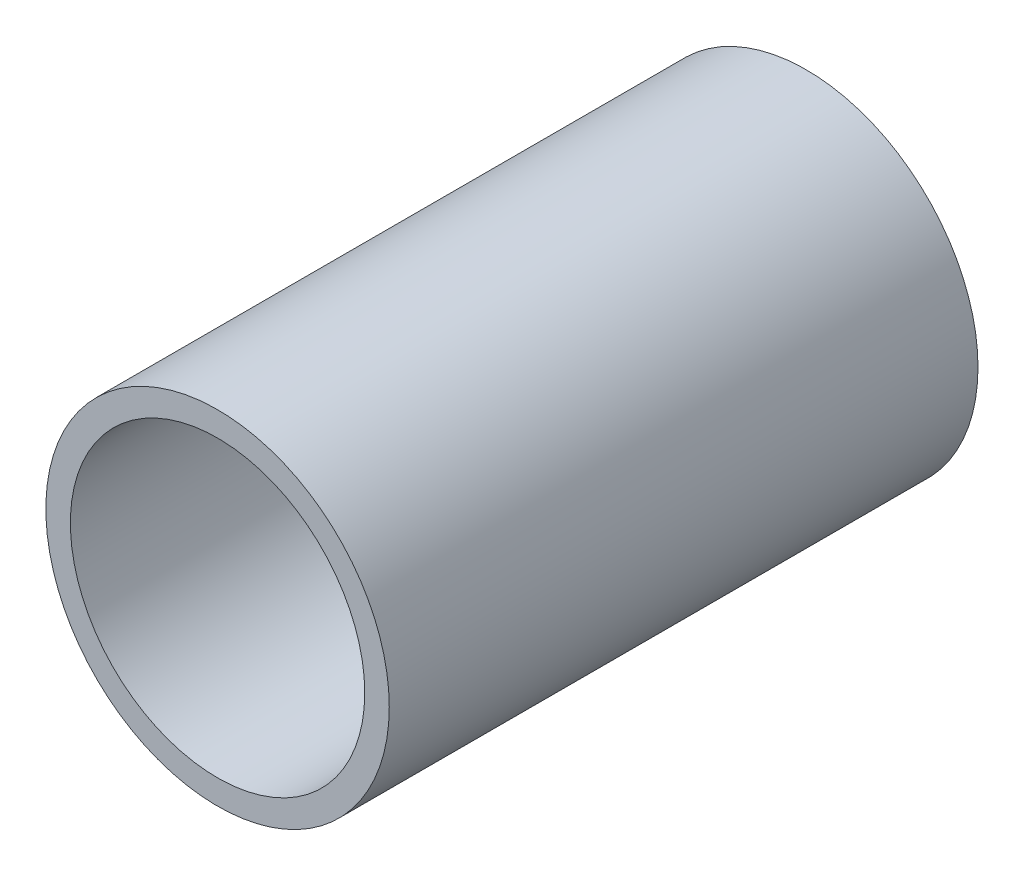
from build123d import *

# Parameters (mm, degrees)
CROQUIS1_R              = 35
CROQUIS1_R_2            = 30
SALIENTE_EXTRUIR1_DEPTH = 120


with BuildPart() as part:
    # Croquis1 → Saliente-Extruir1 (new body)
    with BuildSketch(Plane.XY):
        Circle(CROQUIS1_R)
        Circle(CROQUIS1_R_2, mode=Mode.SUBTRACT)
    extrude(amount=SALIENTE_EXTRUIR1_DEPTH)


solid = part.part
